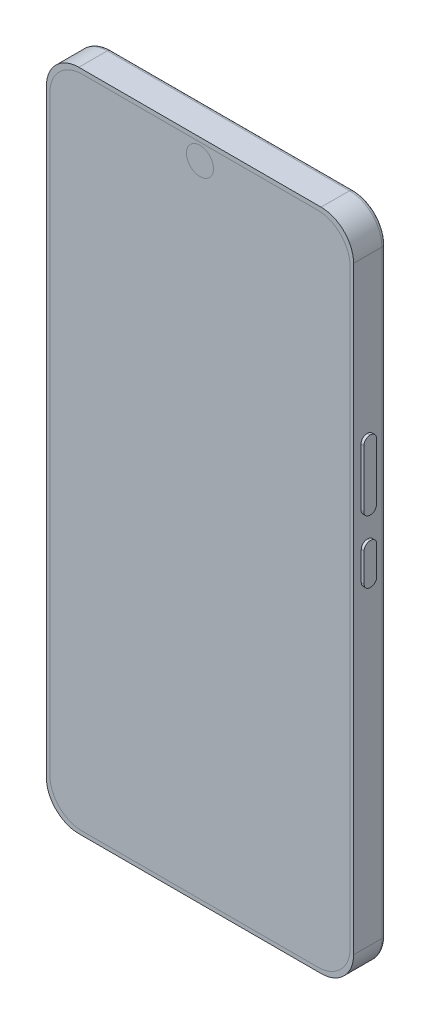
from build123d import *

# Parameters (mm, degrees)
EXTRUDE_2_DEPTH     = 7.99
FILLET_4_R          = 1
EXTRUDE_4_DEPTH     = 0.7
SKETCH_13_R         = 0.94846709
CUT_EXTRUDE_2_DEPTH = 1
CUT_EXTRUDE_3_DEPTH = 1.5
CUT_EXTRUDE_4_DEPTH = 1.5
CUT_EXTRUDE_6_DEPTH = 0.2


with BuildPart() as part:
    # 草图1 → 凸台-拉伸2 (new body)
    with BuildSketch(Plane.XY):
        with BuildLine():
            Line((-62.348303156, 120.705678339), (-2.668303156, 120.705678339))
            ThreePointArc((-2.668303156, 120.705678339), (2.988551094, 118.362532589), (5.331696844, 112.705678339))
            Line((5.331696844, 112.705678339), (5.331696844, -34.824321661))
            ThreePointArc((5.331696844, -34.824321661), (2.988551094, -40.48117591), (-2.668303156, -42.824321661))
            Line((-2.668303156, -42.824321661), (-62.348303156, -42.824321661))
            ThreePointArc((-62.348303156, -42.824321661), (-68.005157405, -40.48117591), (-70.348303156, -34.824321661))
            Line((-70.348303156, -34.824321661), (-70.348303156, 112.705678339))
            ThreePointArc((-70.348303156, 112.705678339), (-68.005157405, 118.362532589), (-62.348303156, 120.705678339))
        make_face()
    extrude(amount=EXTRUDE_2_DEPTH)

    # 圆角4
    fillet_4_edges = [part.edges().sort_by_distance(p)[0] for p in [
        (5.331696844, 38.940678339, 0),
        (2.988551094, -40.48117591, 0),
        (-32.508303156, -42.824321661, 0),
        (-68.005157405, -40.48117591, 0),
        (-70.348303156, 38.940678339, 0),
        (-68.005157405, 118.362532589, 0),
        (-32.508303156, 120.705678339, 0),
        (2.988551094, 118.362532589, 0),
    ]]
    fillet(fillet_4_edges, radius=FILLET_4_R)

    # 草图7 → 凸台-拉伸4 (add)
    with BuildSketch(Plane(origin=(5.331696844, -15.049624304, 0), x_dir=(0, 0, -1), z_dir=(1, 0, 0))):
        with BuildLine():
            Line((-4.598017409, 67.245409355), (-4.480245782, 67.245409355))
            ThreePointArc((-4.480245782, 67.245409355), (-3.41958561, 66.806069527), (-2.980245782, 65.745409355))
            Line((-2.980245782, 65.745409355), (-2.980245782, 58.745409355))
            ThreePointArc((-2.980245782, 58.745409355), (-3.41958561, 57.684749184), (-4.480245782, 57.245409355))
            Line((-4.480245782, 57.245409355), (-4.598017409, 57.245409355))
            ThreePointArc((-4.598017409, 57.245409355), (-5.658677581, 57.684749184), (-6.098017409, 58.745409355))
            Line((-6.098017409, 58.745409355), (-6.098017409, 65.745409355))
            ThreePointArc((-6.098017409, 65.745409355), (-5.658677581, 66.806069527), (-4.598017409, 67.245409355))
        make_face()
        with BuildLine():
            Line((-4.653163904, 89.782491483), (-4.535392277, 89.782491483))
            ThreePointArc((-4.535392277, 89.782491483), (-3.474732105, 89.343151655), (-3.035392277, 88.282491483))
            Line((-3.035392277, 88.282491483), (-3.035392277, 74.219011632))
            ThreePointArc((-3.035392277, 74.219011632), (-3.474732105, 73.15835146), (-4.535392277, 72.719011632))
            Line((-4.535392277, 72.719011632), (-4.653163904, 72.719011632))
            ThreePointArc((-4.653163904, 72.719011632), (-5.713824076, 73.15835146), (-6.153163904, 74.219011632))
            Line((-6.153163904, 74.219011632), (-6.153163904, 88.282491483))
            ThreePointArc((-6.153163904, 88.282491483), (-5.713824076, 89.343151655), (-4.653163904, 89.782491483))
        make_face()
    extrude(amount=EXTRUDE_4_DEPTH)

    # 草图13 → 切除-拉伸2 (cut)
    with BuildSketch(Plane.XZ.offset(42.824321661)):
        with Locations(Location((-59.16469345, 4.443353111, 0), (0, 0, 270))):
            Circle(SKETCH_13_R)
    extrude(amount=-CUT_EXTRUDE_2_DEPTH, mode=Mode.SUBTRACT)

    # 草图14 → 切除-拉伸3 (cut)
    with BuildSketch(Plane.XZ.offset(42.824321661)):
        with BuildLine():
            Line((-35.262920742, 5.531025734), (-28.155701295, 5.531025734))
            ThreePointArc((-28.155701295, 5.531025734), (-27.660726548, 5.32600048), (-27.455701295, 4.831025734))
            Line((-27.455701295, 4.831025734), (-27.455701295, 3.72612223))
            ThreePointArc((-27.455701295, 3.72612223), (-27.660726548, 3.231147483), (-28.155701295, 3.02612223))
            Line((-28.155701295, 3.02612223), (-35.262920742, 3.02612223))
            ThreePointArc((-35.262920742, 3.02612223), (-35.757895489, 3.231147483), (-35.962920742, 3.72612223))
            Line((-35.962920742, 3.72612223), (-35.962920742, 4.831025734))
            ThreePointArc((-35.962920742, 4.831025734), (-35.757895489, 5.32600048), (-35.262920742, 5.531025734))
        make_face()
    extrude(amount=-CUT_EXTRUDE_3_DEPTH, mode=Mode.SUBTRACT)

    # 草图16 → 切除-拉伸4 (cut)
    with BuildSketch(Plane(origin=(0, -42.824321661, 0), x_dir=(-1, 0, 0), z_dir=(0, -1, 0))):
        with BuildLine():
            Line((16.936652763, -5.482735831), (16.77451846, -5.482735831))
            ThreePointArc((16.77451846, -5.482735831), (16.350254392, -5.3069999), (16.17451846, -4.882735831))
            Line((16.17451846, -4.882735831), (16.17451846, -3.642771963))
            ThreePointArc((16.17451846, -3.642771963), (16.350254392, -3.218507894), (16.77451846, -3.042771963))
            Line((16.77451846, -3.042771963), (16.936652763, -3.042771963))
            ThreePointArc((16.936652763, -3.042771963), (17.360916831, -3.218507894), (17.536652763, -3.642771963))
            Line((17.536652763, -3.642771963), (17.536652763, -4.882735831))
            ThreePointArc((17.536652763, -4.882735831), (17.360916831, -5.3069999), (16.936652763, -5.482735831))
        make_face()
        with BuildLine():
            Line((19.482830663, -5.466086098), (19.320696361, -5.466086098))
            ThreePointArc((19.320696361, -5.466086098), (18.896432292, -5.290350167), (18.720696361, -4.866086098))
            Line((18.720696361, -4.866086098), (18.720696361, -3.62612223))
            ThreePointArc((18.720696361, -3.62612223), (18.896432292, -3.201858161), (19.320696361, -3.02612223))
            Line((19.320696361, -3.02612223), (19.482830663, -3.02612223))
            ThreePointArc((19.482830663, -3.02612223), (19.907094732, -3.201858161), (20.082830663, -3.62612223))
            Line((20.082830663, -3.62612223), (20.082830663, -4.866086098))
            ThreePointArc((20.082830663, -4.866086098), (19.907094732, -5.290350167), (19.482830663, -5.466086098))
        make_face()
        with BuildLine():
            Line((14.704169667, -5.495191066), (14.542035364, -5.495191066))
            ThreePointArc((14.542035364, -5.495191066), (14.117771296, -5.319455135), (13.942035364, -4.895191066))
            Line((13.942035364, -4.895191066), (13.942035364, -3.655227198))
            ThreePointArc((13.942035364, -3.655227198), (14.117771296, -3.230963129), (14.542035364, -3.055227198))
            Line((14.542035364, -3.055227198), (14.704169667, -3.055227198))
            ThreePointArc((14.704169667, -3.055227198), (15.128433735, -3.230963129), (15.304169667, -3.655227198))
            Line((15.304169667, -3.655227198), (15.304169667, -4.895191066))
            ThreePointArc((15.304169667, -4.895191066), (15.128433735, -5.319455135), (14.704169667, -5.495191066))
        make_face()
        with BuildLine():
            Line((-17.076276663, -1.219981934), (-17.238410965, -1.219981934))
            ThreePointArc((-17.238410965, -1.219981934), (-17.662675034, -1.044246003), (-17.838410965, -0.619981934))
            Line((-17.838410965, -0.619981934), (-17.838410965, 0.619981934))
            ThreePointArc((-17.838410965, 0.619981934), (-17.662675034, 1.044246003), (-17.238410965, 1.219981934))
            Line((-17.238410965, 1.219981934), (-17.076276663, 1.219981934))
            ThreePointArc((-17.076276663, 1.219981934), (-16.652012594, 1.044246003), (-16.476276663, 0.619981934))
            Line((-16.476276663, 0.619981934), (-16.476276663, -0.619981934))
            ThreePointArc((-16.476276663, -0.619981934), (-16.652012594, -1.044246003), (-17.076276663, -1.219981934))
        make_face()
        with BuildLine():
            Line((12.291999198, -5.500173127), (12.129864896, -5.500173127))
            ThreePointArc((12.129864896, -5.500173127), (11.705600827, -5.324437196), (11.529864896, -4.900173127))
            Line((11.529864896, -4.900173127), (11.529864896, -3.660209259))
            ThreePointArc((11.529864896, -3.660209259), (11.705600827, -3.23594519), (12.129864896, -3.060209259))
            Line((12.129864896, -3.060209259), (12.291999198, -3.060209259))
            ThreePointArc((12.291999198, -3.060209259), (12.716263267, -3.23594519), (12.891999198, -3.660209259))
            Line((12.891999198, -3.660209259), (12.891999198, -4.900173127))
            ThreePointArc((12.891999198, -4.900173127), (12.716263267, -5.324437196), (12.291999198, -5.500173127))
        make_face()
        with BuildLine():
            Line((9.984598284, -5.482371765), (9.822463982, -5.482371765))
            ThreePointArc((9.822463982, -5.482371765), (9.398199913, -5.306635834), (9.222463982, -4.882371765))
            Line((9.222463982, -4.882371765), (9.222463982, -3.642407897))
            ThreePointArc((9.222463982, -3.642407897), (9.398199913, -3.218143828), (9.822463982, -3.042407897))
            Line((9.822463982, -3.042407897), (9.984598284, -3.042407897))
            ThreePointArc((9.984598284, -3.042407897), (10.408862353, -3.218143828), (10.584598284, -3.642407897))
            Line((10.584598284, -3.642407897), (10.584598284, -4.882371765))
            ThreePointArc((10.584598284, -4.882371765), (10.408862353, -5.306635834), (9.984598284, -5.482371765))
        make_face()
        with BuildLine():
            Line((7.784966211, -5.482371765), (7.622831908, -5.482371765))
            ThreePointArc((7.622831908, -5.482371765), (7.19856784, -5.306635834), (7.022831908, -4.882371765))
            Line((7.022831908, -4.882371765), (7.022831908, -3.642407897))
            ThreePointArc((7.022831908, -3.642407897), (7.19856784, -3.218143828), (7.622831908, -3.042407897))
            Line((7.622831908, -3.042407897), (7.784966211, -3.042407897))
            ThreePointArc((7.784966211, -3.042407897), (8.209230279, -3.218143828), (8.384966211, -3.642407897))
            Line((8.384966211, -3.642407897), (8.384966211, -4.882371765))
            ThreePointArc((8.384966211, -4.882371765), (8.209230279, -5.306635834), (7.784966211, -5.482371765))
        make_face()
        with BuildLine():
            Line((40.445771945, -5.535278568), (40.283637643, -5.535278568))
            ThreePointArc((40.283637643, -5.535278568), (39.859373574, -5.359542637), (39.683637643, -4.935278568))
            Line((39.683637643, -4.935278568), (39.683637643, -3.6953147))
            ThreePointArc((39.683637643, -3.6953147), (39.859373574, -3.271050631), (40.283637643, -3.0953147))
            Line((40.283637643, -3.0953147), (40.445771945, -3.0953147))
            ThreePointArc((40.445771945, -3.0953147), (40.870036014, -3.271050631), (41.045771945, -3.6953147))
            Line((41.045771945, -3.6953147), (41.045771945, -4.935278568))
            ThreePointArc((41.045771945, -4.935278568), (40.870036014, -5.359542637), (40.445771945, -5.535278568))
        make_face()
    extrude(amount=-CUT_EXTRUDE_4_DEPTH, mode=Mode.SUBTRACT)

    # 草图18 → 切除-拉伸6 (cut)
    with BuildSketch(Plane(origin=(0, 0, 0), x_dir=(-1, 0, 0), z_dir=(0, 0, -1))):
        with BuildLine():
            Line((25.012472849, 102.092998362), (29.012472849, 102.092998362))
            ThreePointArc((29.012472849, 102.092998362), (29.36602624, 101.946551752), (29.512472849, 101.592998362))
            Line((29.512472849, 101.592998362), (29.512472849, 97.592998362))
            ThreePointArc((29.512472849, 97.592998362), (29.36602624, 97.239444971), (29.012472849, 97.092998362))
            Line((29.012472849, 97.092998362), (25.012472849, 97.092998362))
            ThreePointArc((25.012472849, 97.092998362), (24.658919458, 97.239444971), (24.512472849, 97.592998362))
            Line((24.512472849, 97.592998362), (24.512472849, 101.592998362))
            ThreePointArc((24.512472849, 101.592998362), (24.658919458, 101.946551752), (25.012472849, 102.092998362))
        make_face()
        with BuildLine():
            Line((24.948975022, 111.702722859), (28.948975022, 111.702722859))
            ThreePointArc((28.948975022, 111.702722859), (29.302528413, 111.55627625), (29.448975022, 111.202722859))
            Line((29.448975022, 111.202722859), (29.448975022, 107.202722859))
            ThreePointArc((29.448975022, 107.202722859), (29.302528413, 106.849169469), (28.948975022, 106.702722859))
            Line((28.948975022, 106.702722859), (24.948975022, 106.702722859))
            ThreePointArc((24.948975022, 106.702722859), (24.595421632, 106.849169469), (24.448975022, 107.202722859))
            Line((24.448975022, 107.202722859), (24.448975022, 111.202722859))
            ThreePointArc((24.448975022, 111.202722859), (24.595421632, 111.55627625), (24.948975022, 111.702722859))
        make_face()
    extrude(amount=-CUT_EXTRUDE_6_DEPTH, mode=Mode.SUBTRACT)


solid = part.part
